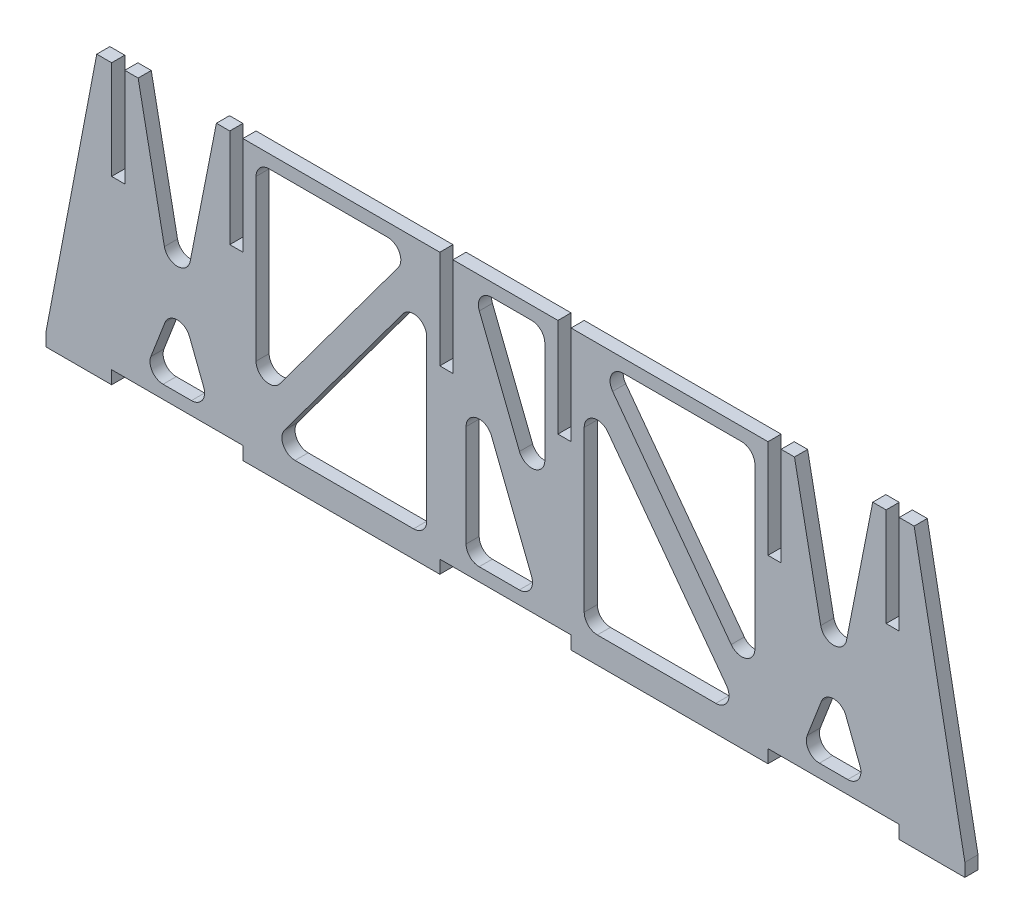
from build123d import *

# Parameters (mm, degrees)
BOSS_EXTRUDE1_DEPTH = 4


with BuildPart() as part:
    # Sketch2 → Boss-Extrude1 (new body)
    with BuildSketch(Plane.XY):
        with BuildLine():
            Line((-138.118918248, -4), (-138.118918248, -8))
            Line((-138.118918248, -8), (-118.118918248, -8))
            Line((-118.118918248, -8), (-118.118918248, -4))
            Line((-118.118918248, -4), (-78.118918248, -4))
            Line((-78.118918248, -4), (-78.118918248, -8))
            Line((-78.118918248, -8), (-18.118918248, -8))
            Line((-18.118918248, -8), (-18.118918248, -4))
            Line((-18.118918248, -4), (21.881081752, -4))
            Line((21.881081752, -4), (21.881081752, -8))
            Line((21.881081752, -8), (81.881081752, -8))
            Line((81.881081752, -8), (81.881081752, -4))
            Line((81.881081752, -4), (121.881081752, -4))
            Line((121.881081752, -4), (121.881081752, -8))
            Line((121.881081752, -8), (141.881081752, -8))
            Line((141.881081752, -8), (141.881081752, -4))
            Line((141.881081752, -4), (126.420932439, 77))
            Line((126.420932439, 77), (121.881081752, 77))
            Line((121.881081752, 77), (121.881081752, 47))
            Line((121.881081752, 47), (117.881081752, 47))
            Line((117.881081752, 47), (117.881081752, 77))
            Line((117.881081752, 77), (113.803791589, 77))
            Line((113.803791589, 77), (105.805256721, 36.507417232))
            ThreePointArc((105.805256721, 36.507417232), (101.881081752, 33.282562905), (97.956906783, 36.507417232))
            Line((97.956906783, 36.507417232), (89.958371916, 77))
            Line((89.958371916, 77), (85.881081752, 77))
            Line((85.881081752, 77), (85.881081752, 47))
            Line((85.881081752, 47), (81.881081752, 47))
            Line((81.881081752, 47), (81.881081752, 77))
            Line((81.881081752, 77), (21.881081752, 77))
            Line((21.881081752, 77), (21.881081752, 47))
            Line((21.881081752, 47), (17.881081752, 47))
            Line((17.881081752, 47), (17.881081752, 77))
            Line((17.881081752, 77), (-14.118918248, 77))
            Line((-14.118918248, 77), (-14.118918248, 47))
            Line((-14.118918248, 47), (-18.118918248, 47))
            Line((-18.118918248, 47), (-18.118918248, 77))
            Line((-18.118918248, 77), (-78.118918248, 77))
            Line((-78.118918248, 77), (-78.118918248, 47))
            Line((-78.118918248, 47), (-82.118918248, 47))
            Line((-82.118918248, 47), (-82.118918248, 77))
            Line((-82.118918248, 77), (-86.196208411, 77))
            Line((-86.196208411, 77), (-94.194743279, 36.507417232))
            ThreePointArc((-94.194743279, 36.507417232), (-98.118918248, 33.282562905), (-102.043093217, 36.507417232))
            Line((-102.043093217, 36.507417232), (-110.041628084, 77))
            Line((-110.041628084, 77), (-114.118918248, 77))
            Line((-114.118918248, 77), (-114.118918248, 47))
            Line((-114.118918248, 47), (-118.118918248, 47))
            Line((-118.118918248, 47), (-118.118918248, 77))
            Line((-118.118918248, 77), (-122.658768935, 77))
            Line((-122.658768935, 77), (-138.118918248, -4))
        make_face()
        with BuildLine():
            Line((-102.438497969, 0), (-93.799338527, 0))
            ThreePointArc((-93.799338527, 0), (-90.499180816, 1.739699338), (-90.069664197, 5.445520459))
            Line((-90.069664197, 5.445520459), (-94.389243919, 16.590728056))
            ThreePointArc((-94.389243919, 16.590728056), (-98.118918248, 19.145207598), (-101.848592577, 16.590728056))
            Line((-101.848592577, 16.590728056), (-106.168172299, 5.445520459))
            ThreePointArc((-106.168172299, 5.445520459), (-105.73865568, 1.739699338), (-102.438497969, 0))
        make_face(mode=Mode.SUBTRACT)
        with BuildLine():
            Line((-22.118918248, 4), (-22.118918248, 52.759761907))
            ThreePointArc((-22.118918248, 52.759761907), (-24.865306485, 56.558242859), (-29.333147021, 55.140672109))
            Line((-29.333147021, 55.140672109), (-65.451489175, 6.380910203))
            ThreePointArc((-65.451489175, 6.380910203), (-65.80962942, 2.200505739), (-62.237260401, 0))
            Line((-62.237260401, 0), (-26.118918248, 0))
            ThreePointArc((-26.118918248, 0), (-23.290491123, 1.171572875), (-22.118918248, 4))
        make_face(mode=Mode.SUBTRACT)
        with BuildLine():
            Line((-34.000576095, 73), (-70.118918248, 73))
            ThreePointArc((-70.118918248, 73), (-72.947345373, 71.828427125), (-74.118918248, 69))
            Line((-74.118918248, 69), (-74.118918248, 20.240238093))
            ThreePointArc((-74.118918248, 20.240238093), (-71.372530011, 16.441757141), (-66.904689475, 17.859327891))
            Line((-66.904689475, 17.859327891), (-30.786347321, 66.619089797))
            ThreePointArc((-30.786347321, 66.619089797), (-30.428207076, 70.799494261), (-34.000576095, 73))
        make_face(mode=Mode.SUBTRACT)
        with BuildLine():
            Line((9.881081752, 73), (-2.356754744, 73))
            ThreePointArc((-2.356754744, 73), (-5.664234687, 71.249572499), (-6.076962704, 67.530288213))
            Line((-6.076962704, 67.530288213), (6.160873792, 36.553264583))
            ThreePointArc((6.160873792, 36.553264583), (10.62913528, 34.093546905), (13.881081752, 38.02297637))
            Line((13.881081752, 38.02297637), (13.881081752, 69))
            ThreePointArc((13.881081752, 69), (12.709508877, 71.828427125), (9.881081752, 73))
        make_face(mode=Mode.SUBTRACT)
        with BuildLine():
            Line((-6.118918248, 0), (6.118918248, 0))
            ThreePointArc((6.118918248, 0), (9.426398191, 1.750427501), (9.839126208, 5.469711787))
            Line((9.839126208, 5.469711787), (-2.398710288, 36.446735417))
            ThreePointArc((-2.398710288, 36.446735417), (-6.866971776, 38.906453095), (-10.118918248, 34.97702363))
            Line((-10.118918248, 34.97702363), (-10.118918248, 4))
            ThreePointArc((-10.118918248, 4), (-8.947345373, 1.171572875), (-6.118918248, 0))
        make_face(mode=Mode.SUBTRACT)
        with BuildLine():
            Line((105.610756081, 16.590728056), (109.930335803, 5.445520459))
            ThreePointArc((109.930335803, 5.445520459), (109.500819184, 1.739699338), (106.200661473, 0))
            Line((106.200661473, 0), (97.561502031, 0))
            ThreePointArc((97.561502031, 0), (94.26134432, 1.739699338), (93.831827701, 5.445520459))
            Line((93.831827701, 5.445520459), (98.151407423, 16.590728056))
            ThreePointArc((98.151407423, 16.590728056), (101.881081752, 19.145207598), (105.610756081, 16.590728056))
        make_face(mode=Mode.SUBTRACT)
        with BuildLine():
            Line((70.666852979, 17.859327891), (34.548510825, 66.619089797))
            ThreePointArc((34.548510825, 66.619089797), (34.19037058, 70.799494261), (37.762739599, 73))
            Line((37.762739599, 73), (73.881081752, 73))
            ThreePointArc((73.881081752, 73), (76.709508877, 71.828427125), (77.881081752, 69))
            Line((77.881081752, 69), (77.881081752, 20.240238093))
            ThreePointArc((77.881081752, 20.240238093), (75.134693515, 16.441757141), (70.666852979, 17.859327891))
        make_face(mode=Mode.SUBTRACT)
        with BuildLine():
            Line((65.999423905, 0), (29.881081752, 0))
            ThreePointArc((29.881081752, 0), (27.052654627, 1.171572875), (25.881081752, 4))
            Line((25.881081752, 4), (25.881081752, 52.759761907))
            ThreePointArc((25.881081752, 52.759761907), (28.627469989, 56.558242859), (33.095310525, 55.140672109))
            Line((33.095310525, 55.140672109), (69.213652679, 6.380910203))
            ThreePointArc((69.213652679, 6.380910203), (69.571792924, 2.200505739), (65.999423905, 0))
        make_face(mode=Mode.SUBTRACT)
    extrude(amount=BOSS_EXTRUDE1_DEPTH)


solid = part.part
